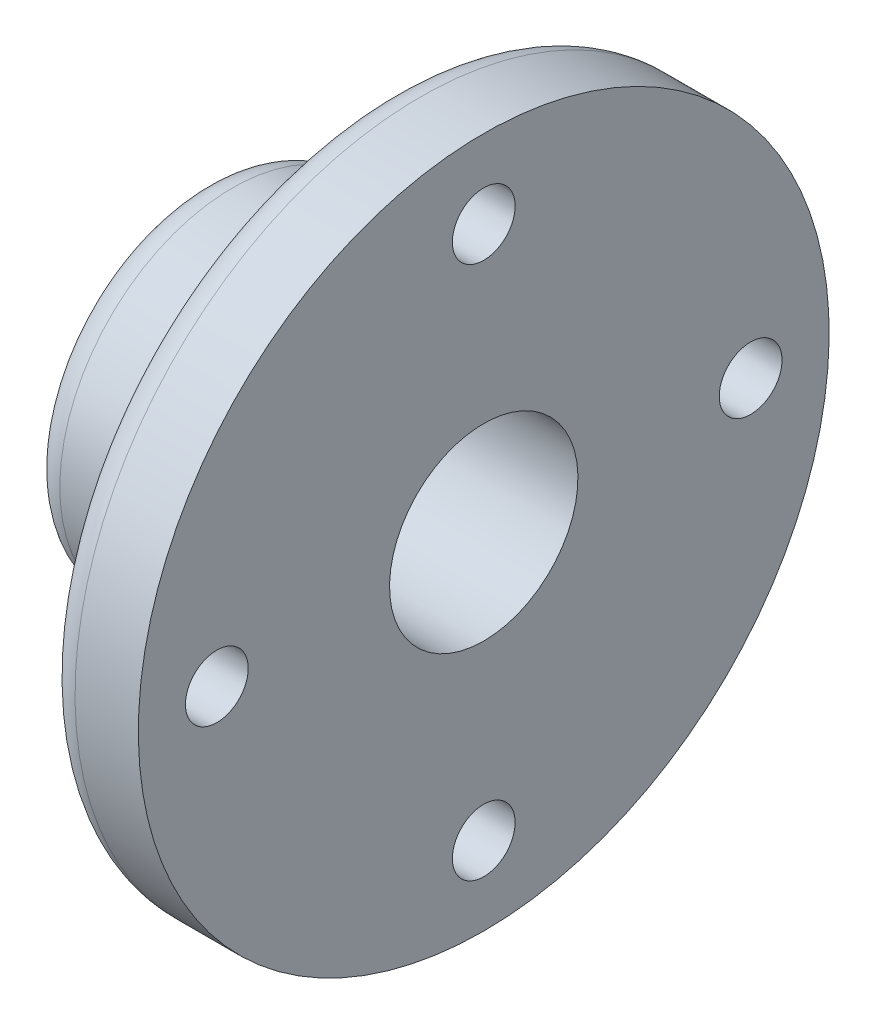
from build123d import *

# Parameters (mm, degrees)
SKETCH2_R          = 6.35
CUT_EXTRUDE1_DEPTH = 106.839139341
CIRPATTERN1_COUNT  = 4


with BuildPart() as part:
    # Sketch1 → Revolve1 (revolve)
    with BuildSketch(Plane.XY, mode=Mode.PRIVATE) as revolve1_sk:
        with BuildLine():
            Line((-55.118, 19.05), (0, 19.05))
            Line((0, 19.05), (0, 69.85))
            Line((0, 69.85), (-12.8016, 69.85))
            ThreePointArc((-12.8016, 69.85), (-17.291728061, 67.990128061), (-19.1516, 63.5))
            Line((-19.1516, 63.5), (-19.1516, 41.275))
            ThreePointArc((-19.1516, 41.275), (-21.011471939, 36.784871939), (-25.5016, 34.925))
            Line((-25.5016, 34.925), (-50.8, 34.925))
            ThreePointArc((-50.8, 34.925), (-55.290128061, 33.065128061), (-57.15, 28.575))
            Line((-57.15, 28.575), (-57.15, 21.082))
            Line((-57.15, 21.082), (-55.118, 19.05))
        make_face()
    revolve(revolve1_sk.sketch.rotate(Axis((-117.274050633, 0, 0), (1, 0, 0)), 180), axis=Axis((-117.274050633, 0, 0), (1, 0, 0)))

    # Sketch2 → Cut-Extrude1 (cut, through all)
    with BuildSketch(Plane.ZY.offset(19.1516)):
        with Locations(Location((0, 53.975, 0), (0, 0, 270))):
            Circle(SKETCH2_R)
    cut_extrude1 = extrude(amount=-CUT_EXTRUDE1_DEPTH, mode=Mode.SUBTRACT)

    # CirPattern1: Cut-Extrude1 ×4 about axis
    cirpattern1_axis = Axis((0, 0, 0), (1, 0, 0))
    for i in range(1, CIRPATTERN1_COUNT):
        add(cut_extrude1.rotate(cirpattern1_axis, i * 360 / CIRPATTERN1_COUNT), mode=Mode.SUBTRACT)


solid = part.part
